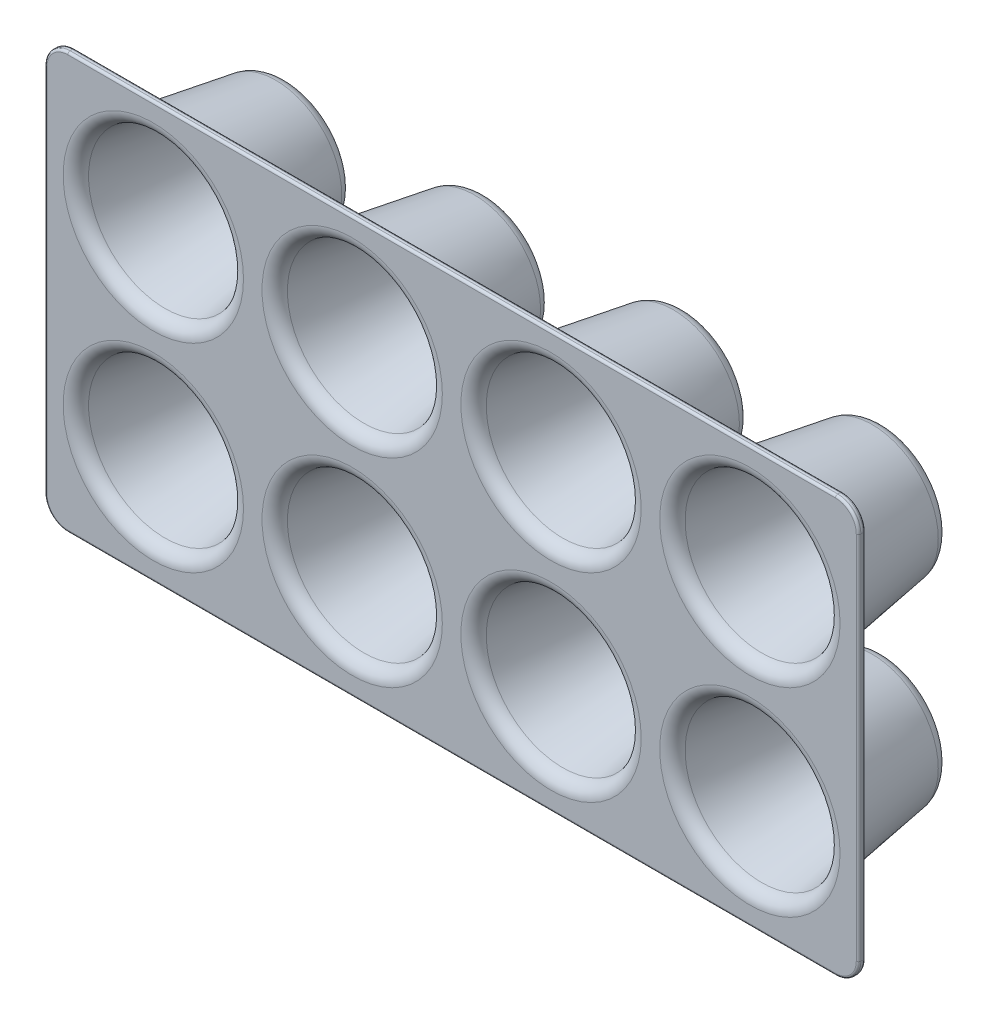
from build123d import *

# Parameters (mm, degrees)
LPATTERN1_COUNT     = 4
LPATTERN1_PITCH     = 86
LPATTERN1_2_COUNT   = 2
LPATTERN1_2_PITCH   = 86
SKETCH2_W           = 180
SKETCH2_H           = 352
SKETCH2_R           = 39
BOSS_EXTRUDE1_DEPTH = 3
FILLET1_R           = 10
FILLET2_R           = 1


with BuildPart() as part:
    # Sketch1 → Revolve-Thin1 (revolve)
    with BuildSketch(Plane.YZ, mode=Mode.PRIVATE) as revolve_thin1_sk:
        with BuildLine():
            ThreePointArc((-39, 0), (-37.051655855, -0.718782103), (-36.036934978, -2.530696605))
            Line((-36.036934978, -2.530696605), (-28.528259657, -49.93860679))
            ThreePointArc((-28.528259657, -49.93860679), (-26.498817903, -53.562435794), (-22.602129613, -55))
            Line((-22.602129613, -55), (0, -55))
            Line((0, -55), (0, -52))
            Line((0, -52), (-22.602129613, -52))
            ThreePointArc((-22.602129613, -52), (-24.550473758, -51.281217897), (-25.565194635, -49.469303395))
            Line((-25.565194635, -49.469303395), (-33.073869956, -2.06139321))
            ThreePointArc((-33.073869956, -2.06139321), (-35.10331171, 1.562435794), (-39, 3))
            Line((-39, 3), (-39, 0))
        make_face()
    revolve(revolve_thin1_sk.sketch.rotate(Axis((0, 0, 59.060164942), (0, 0, -1)), 270), axis=Axis((0, 0, 59.060164942), (0, 0, -1)))


with BuildPart() as lpattern1_1:
    # LPattern1: pattern copy
    add(part.part.moved(Location(Vector(-1, 0, 0) * (1 * LPATTERN1_PITCH))))


with BuildPart() as lpattern1_2:
    # LPattern1: pattern copy
    add(part.part.moved(Location(Vector(-1, 0, 0) * (2 * LPATTERN1_PITCH))))


with BuildPart() as lpattern1_3:
    # LPattern1: pattern copy
    add(part.part.moved(Location(Vector(-1, 0, 0) * (3 * LPATTERN1_PITCH))))


with BuildPart() as lpattern1_2_1:
    # LPattern1 2: pattern copy
    add(part.part.moved(Location(Vector(0, 1, 0) * (1 * LPATTERN1_2_PITCH))))


with BuildPart() as lpattern1_2_2:
    # LPattern1 2: pattern copy
    add(lpattern1_1.part.moved(Location(Vector(0, 1, 0) * (1 * LPATTERN1_2_PITCH))))


with BuildPart() as lpattern1_2_3:
    # LPattern1 2: pattern copy
    add(lpattern1_2.part.moved(Location(Vector(0, 1, 0) * (1 * LPATTERN1_2_PITCH))))


with BuildPart() as lpattern1_2_4:
    # LPattern1 2: pattern copy
    add(lpattern1_3.part.moved(Location(Vector(0, 1, 0) * (1 * LPATTERN1_2_PITCH))))


with BuildPart() as part_1:
    add(part.part)

    add(lpattern1_1.part)  # Boss-Extrude1 merges LPattern1_1

    add(lpattern1_2.part)  # Boss-Extrude1 merges LPattern1_2

    add(lpattern1_3.part)  # Boss-Extrude1 merges LPattern1_3

    add(lpattern1_2_1.part)  # Boss-Extrude1 merges LPattern1 2_1

    add(lpattern1_2_2.part)  # Boss-Extrude1 merges LPattern1 2_2

    add(lpattern1_2_3.part)  # Boss-Extrude1 merges LPattern1 2_3

    add(lpattern1_2_4.part)  # Boss-Extrude1 merges LPattern1 2_4
    # Sketch2 → Boss-Extrude1 (add)
    with BuildSketch(Plane(origin=(0, 0, 0), x_dir=(0, 1, 0), z_dir=(0, 0, 1))):
        with Locations((43, 129)):
            Rectangle(SKETCH2_W, SKETCH2_H)
        with Locations((0, 258)):
            Circle(SKETCH2_R, mode=Mode.SUBTRACT)
        with Locations((86, 258)):
            Circle(SKETCH2_R, mode=Mode.SUBTRACT)
        with Locations((0, 172)):
            Circle(SKETCH2_R, mode=Mode.SUBTRACT)
        with Locations((86, 172)):
            Circle(SKETCH2_R, mode=Mode.SUBTRACT)
        with Locations((0, 86)):
            Circle(SKETCH2_R, mode=Mode.SUBTRACT)
        with Locations((86, 86)):
            Circle(SKETCH2_R, mode=Mode.SUBTRACT)
        with Locations((86, 0)):
            Circle(SKETCH2_R, mode=Mode.SUBTRACT)
        Circle(SKETCH2_R, mode=Mode.SUBTRACT)
    extrude(amount=BOSS_EXTRUDE1_DEPTH)

    # Fillet1
    fillet1_edges = [part_1.edges().sort_by_distance(p)[0] for p in [
        (47, 133, 1.5),
        (-305, 133, 1.5),
        (-305, -47, 1.5),
        (47, -47, 1.5),
    ]]
    fillet(fillet1_edges, radius=FILLET1_R)

    # Fillet2
    fillet2_edges = [part_1.edges().sort_by_distance(p)[0] for p in [
        (-129, 133, 0),
        (-129, 133, 3),
        (47, 43, 0),
        (-129, -47, 0),
        (-305, 43, 0),
        (-302.071067812, -44.071067812, 0),
        (-302.071067812, 130.071067812, 0),
        (44.071067812, -44.071067812, 0),
        (44.071067812, 130.071067812, 0),
        (47, 43, 3),
        (-305, 43, 3),
        (-129, -47, 3),
        (-302.071067812, -44.071067812, 3),
        (-302.071067812, 130.071067812, 3),
        (44.071067812, -44.071067812, 3),
        (44.071067812, 130.071067812, 3),
    ]]
    fillet(fillet2_edges, radius=FILLET2_R)


solid = part_1.part
